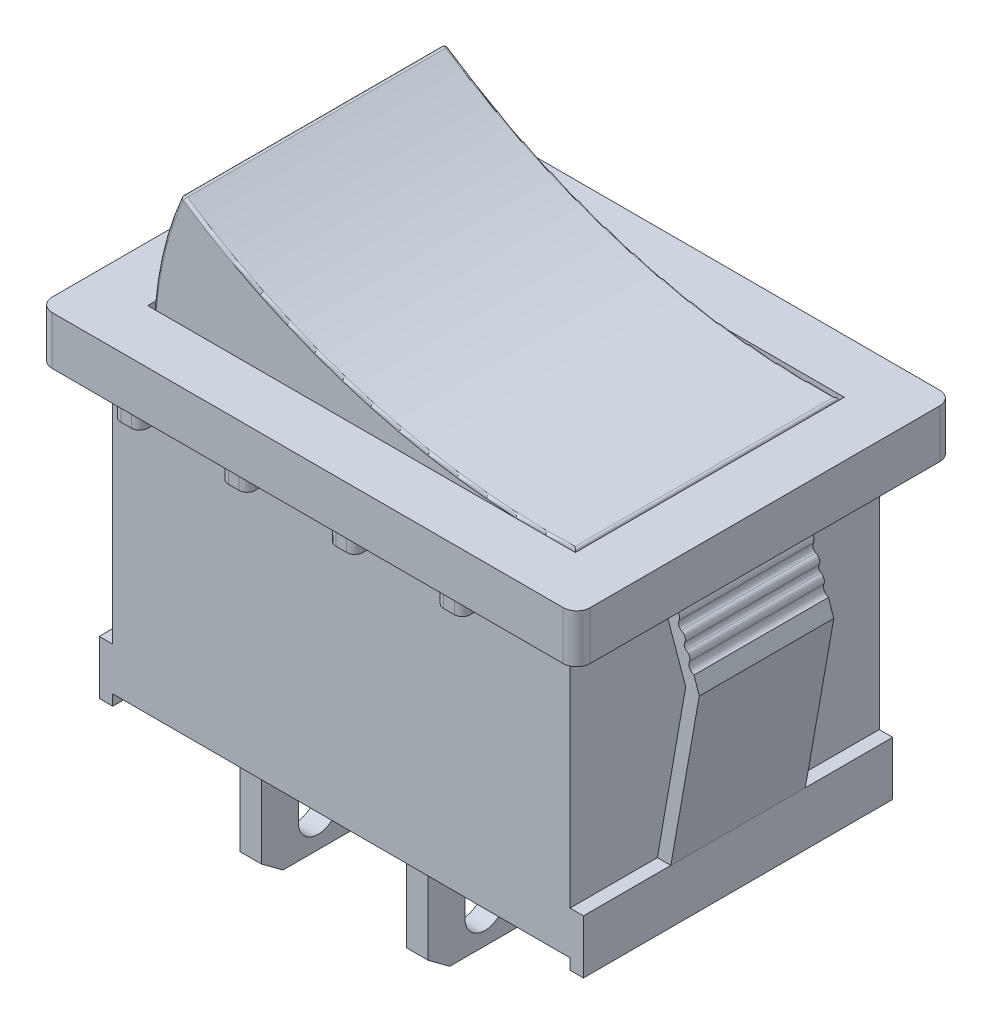
from build123d import *

# Parameters (mm, degrees)
BOSS_EXTRUDE1_DEPTH  = 11.5
SKETCH2_W            = 20
SKETCH2_H            = 14
BOSS_EXTRUDE2_DEPTH  = 1.8
BOSS_EXTRUDE3_DEPTH  = 5
SKETCH4_R            = 0.997087564
BOSS_EXTRUDE4_DEPTH  = 0.8
LPATTERN1_COUNT      = 2
LPATTERN1_PITCH      = 6.2
BOSS_EXTRUDE5_DEPTH  = 1.2
LPATTERN2_COUNT      = 4
LPATTERN2_PITCH      = 4
MIRROR1_COPY_1_DEPTH = 1.2
MIRROR1_COPY_2_DEPTH = 1.2
MIRROR1_COPY_3_DEPTH = 1.2
SKETCH7_W            = 17
SKETCH7_H            = 10
CUT_EXTRUDE1_DEPTH   = 1.5
BOSS_EXTRUDE7_DEPTH  = 9.8
SKETCH9_W            = 10.51284516
SKETCH9_H            = 1.648785174
BOSS_EXTRUDE8_DEPTH  = 0.55
SKETCH10_W           = 11.976389477
SKETCH10_H           = 1.66854767
BOSS_EXTRUDE9_DEPTH  = 0.55
FILLET1_R            = 0.5
FILLET2_R            = 0.1
BOSS_EXTRUDE10_REACH = 27.692
SKETCH11_W           = 3.457236269
SKETCH11_H           = 0.250916354


with BuildPart() as part:
    # Sketch1 → Boss-Extrude1 (new body)
    with BuildSketch(Plane.XY):
        Polygon((8.18934202, -3.835807166), (8.18934202, 5.164192834), (-8.81065798, 5.164192834), (-8.81065798, -3.835807166), (-9.31065798, -3.835807166), (-9.31065798, -5.835807166), (-8.81065798, -5.835807166), (-8.81065798, -5.435807166), (8.18934202, -5.435807166), (8.18934202, -5.835807166), (8.68934202, -5.835807166), (8.68934202, -3.835807166), align=None)
    extrude(amount=BOSS_EXTRUDE1_DEPTH)

    # Sketch2 → Boss-Extrude2 (add)
    with BuildSketch(Plane(origin=(0, 5.164192834, 0), x_dir=(1, 0, 0), z_dir=(0, 1, 0))):
        with Locations((-0.31065798, -5.75)):
            Rectangle(SKETCH2_W, SKETCH2_H)
    extrude(amount=BOSS_EXTRUDE2_DEPTH)

    # Sketch3 → Boss-Extrude3 (add)
    with BuildSketch(Plane.XY.offset(8.25)):
        with BuildLine():
            ThreePointArc((8.8583586, 4.521792747), (8.783242122, 4.675493292), (8.838809449, 4.83729136))
            ThreePointArc((8.838809449, 4.83729136), (8.833116674, 4.990542648), (8.729820429, 5.103892772))
            Line((8.729820429, 5.103892772), (8.729820429, 5.164192834))
            Line((8.729820429, 5.164192834), (8.18934202, 5.164192834))
            Line((8.18934202, 5.164192834), (9.241295814, 2.192836618))
            Line((9.241295814, 2.192836618), (8.18934202, -3.835807166))
            Line((8.18934202, -3.835807166), (8.68934202, -3.835807166))
            Line((8.68934202, -3.835807166), (9.74705296, 2.145085562))
            Line((9.74705296, 2.145085562), (9.54876746, 2.725463203))
            ThreePointArc((9.54876746, 2.725463203), (9.392073601, 2.857680829), (9.374766289, 3.061972099))
            ThreePointArc((9.374766289, 3.061972099), (9.386055579, 3.239564558), (9.26846148, 3.373124123))
            ThreePointArc((9.26846148, 3.373124123), (9.190190153, 3.486993506), (9.215361781, 3.622857506))
            ThreePointArc((9.215361781, 3.622857506), (9.209882663, 3.798156896), (9.082052954, 3.918237963))
            ThreePointArc((9.082052954, 3.918237963), (8.982000627, 4.045183698), (9.001017139, 4.205695566))
            ThreePointArc((9.001017139, 4.205695566), (8.995153739, 4.393289707), (8.8583586, 4.521792747))
        make_face()
        with BuildLine():
            Line((-9.768549251, 2.192836618), (-8.81065798, -3.835807166))
            Line((-8.81065798, -3.835807166), (-9.31065798, -3.835807166))
            Line((-9.31065798, -3.835807166), (-10.281052634, 2.145085562))
            Line((-10.281052634, 2.145085562), (-10.117876765, 2.665799097))
            ThreePointArc((-10.117876765, 2.665799097), (-9.936719279, 2.855408951), (-9.942696007, 3.117581051))
            ThreePointArc((-9.942696007, 3.117581051), (-9.904975068, 3.30471482), (-9.745978779, 3.410365644))
            ThreePointArc((-9.745978779, 3.410365644), (-9.685187207, 3.557129482), (-9.745978779, 3.703893321))
            ThreePointArc((-9.745978779, 3.703893321), (-9.70731856, 3.876152755), (-9.558175844, 3.970621666))
            ThreePointArc((-9.558175844, 3.970621666), (-9.525748947, 4.115107108), (-9.604986305, 4.240203023))
            ThreePointArc((-9.604986305, 4.240203023), (-9.516840398, 4.401701032), (-9.377451419, 4.521792747))
            ThreePointArc((-9.377451419, 4.521792747), (-9.313695789, 4.655646945), (-9.403030201, 4.773973145))
            Line((-9.403030201, 4.773973145), (-9.247843309, 5.164192834))
            Line((-9.247843309, 5.164192834), (-8.81065798, 5.164192834))
            Line((-8.81065798, 5.164192834), (-9.768549251, 2.192836618))
        make_face()
    extrude(amount=-BOSS_EXTRUDE3_DEPTH)

    # Sketch4 → Boss-Extrude4 (add)
    with BuildSketch(Plane(origin=(-7.71065798, 0, 0), x_dir=(0, 0, -1), z_dir=(1, 0, 0))):
        with BuildLine():
            Line((-4.469576646, -12.375307487), (-3.670369945, -11.774251208))
            Line((-3.670369945, -11.774251208), (-3.670369945, -6.737274439))
            ThreePointArc((-3.670369945, -6.737274439), (-3.640744564, -6.68616232), (-3.584133005, -6.66927317))
            Line((-3.584133005, -6.66927317), (-3.457236269, -6.66927317))
            Line((-3.457236269, -6.66927317), (-3.457236269, -5.36927317))
            Line((-3.457236269, -5.36927317), (-8.071520276, -5.36927317))
            Line((-8.071520276, -5.36927317), (-8.071520276, -6.66927317))
            Line((-8.071520276, -6.66927317), (-7.942223139, -6.66927317))
            ThreePointArc((-7.942223139, -6.66927317), (-7.892318864, -6.691603733), (-7.872821304, -6.742681477))
            Line((-7.872821304, -6.742681477), (-7.872821304, -11.779658246))
            Line((-7.872821304, -11.779658246), (-7.069576646, -12.375307487))
            Line((-7.069576646, -12.375307487), (-4.469576646, -12.375307487))
        make_face()
        with Locations((-5.759828942, -7.049379416)):
            Circle(SKETCH4_R, mode=Mode.SUBTRACT)
        with BuildLine():
            Line((-5.018096399, -9.591172621), (-5.018096399, -11.135690223))
            ThreePointArc((-5.018096399, -11.135690223), (-5.759828942, -11.877422766), (-6.501561485, -11.135690223))
            Line((-6.501561485, -11.135690223), (-6.501561485, -9.591172621))
            ThreePointArc((-6.501561485, -9.591172621), (-5.759828942, -8.849440078), (-5.018096399, -9.591172621))
        make_face(mode=Mode.SUBTRACT)
    boss_extrude4 = extrude(amount=BOSS_EXTRUDE4_DEPTH)

    # LPattern1: Boss-Extrude4 ×2
    with Locations(*[(i * LPATTERN1_PITCH, 0, 0) for i in range(1, LPATTERN1_COUNT)]):
        add(boss_extrude4)

    # Sketch5 → Boss-Extrude5 (add)
    with BuildSketch(Plane.XZ.offset(-5.164192834)):
        with BuildLine():
            Line((-8.31065798, 11.5), (-8.31065798, 11.7))
            ThreePointArc((-8.31065798, 11.7), (-8.222790015, 11.912132034), (-8.01065798, 12))
            Line((-8.01065798, 12), (-7.61065798, 12))
            ThreePointArc((-7.61065798, 12), (-7.398525946, 11.912132034), (-7.31065798, 11.7))
            Line((-7.31065798, 11.7), (-7.31065798, 11.5))
            Line((-7.31065798, 11.5), (-8.31065798, 11.5))
        make_face()
    boss_extrude5 = extrude(amount=BOSS_EXTRUDE5_DEPTH)

    # LPattern2: Boss-Extrude5 ×4
    with Locations(*[(i * LPATTERN2_PITCH, 0, 0) for i in range(1, LPATTERN2_COUNT)]):
        add(boss_extrude5)

    # Mirror1: Boss-Extrude5 across plane
    add(boss_extrude5.mirror(Plane.XY.offset(5.75)))

    # Mirror1 copy 1 sketch → Mirror1 copy 1 (add)
    with BuildSketch(Plane(origin=(4, 5.164192834, 11.5), x_dir=(1, 0, 0), z_dir=(0, -1, 0))):
        with BuildLine():
            Line((-8.31065798, -11.5), (-8.31065798, -11.7))
            ThreePointArc((-8.31065798, -11.7), (-8.222790015, -11.912132034), (-8.01065798, -12))
            Line((-8.01065798, -12), (-7.61065798, -12))
            ThreePointArc((-7.61065798, -12), (-7.398525946, -11.912132034), (-7.31065798, -11.7))
            Line((-7.31065798, -11.7), (-7.31065798, -11.5))
            Line((-7.31065798, -11.5), (-8.31065798, -11.5))
        make_face()
    extrude(amount=MIRROR1_COPY_1_DEPTH)

    # Mirror1 copy 2 sketch → Mirror1 copy 2 (add)
    with BuildSketch(Plane(origin=(8, 5.164192834, 11.5), x_dir=(1, 0, 0), z_dir=(0, -1, 0))):
        with BuildLine():
            Line((-8.31065798, -11.5), (-8.31065798, -11.7))
            ThreePointArc((-8.31065798, -11.7), (-8.222790015, -11.912132034), (-8.01065798, -12))
            Line((-8.01065798, -12), (-7.61065798, -12))
            ThreePointArc((-7.61065798, -12), (-7.398525946, -11.912132034), (-7.31065798, -11.7))
            Line((-7.31065798, -11.7), (-7.31065798, -11.5))
            Line((-7.31065798, -11.5), (-8.31065798, -11.5))
        make_face()
    extrude(amount=MIRROR1_COPY_2_DEPTH)

    # Mirror1 copy 3 sketch → Mirror1 copy 3 (add)
    with BuildSketch(Plane(origin=(12, 5.164192834, 11.5), x_dir=(1, 0, 0), z_dir=(0, -1, 0))):
        with BuildLine():
            Line((-8.31065798, -11.5), (-8.31065798, -11.7))
            ThreePointArc((-8.31065798, -11.7), (-8.222790015, -11.912132034), (-8.01065798, -12))
            Line((-8.01065798, -12), (-7.61065798, -12))
            ThreePointArc((-7.61065798, -12), (-7.398525946, -11.912132034), (-7.31065798, -11.7))
            Line((-7.31065798, -11.7), (-7.31065798, -11.5))
            Line((-7.31065798, -11.5), (-8.31065798, -11.5))
        make_face()
    extrude(amount=MIRROR1_COPY_3_DEPTH)

    # Sketch7 → Cut-Extrude1 (cut)
    with BuildSketch(Plane(origin=(0, 6.964192834, 0), x_dir=(1, 0, 0), z_dir=(0, 1, 0))):
        with Locations((-0.31065798, -5.75)):
            Rectangle(SKETCH7_W, SKETCH7_H)
    extrude(amount=-CUT_EXTRUDE1_DEPTH, mode=Mode.SUBTRACT)

    # Sketch8 → Boss-Extrude7 (add)
    with BuildSketch(Plane.XY.offset(0.85)):
        with BuildLine():
            Line((7.53934202, 5.445280313), (7.53934202, 6.964192834))
            ThreePointArc((7.53934202, 6.964192834), (-0.098559128, 7.844883043), (-7.08211842, 11.060944111))
            ThreePointArc((-7.08211842, 11.060944111), (-7.943068249, 8.314893806), (-8.16065798, 5.445280313))
            Line((-8.16065798, 5.445280313), (7.53934202, 5.445280313))
        make_face()
    extrude(amount=BOSS_EXTRUDE7_DEPTH)

    # Sketch9 → Boss-Extrude8 (add)
    with BuildSketch(Plane(origin=(-8.81065798, 0, 0), x_dir=(0, 0, -1), z_dir=(1, 0, 0))):
        with Locations((-5.794182097, 6.139800247)):
            Rectangle(SKETCH9_W, SKETCH9_H)
    extrude(amount=BOSS_EXTRUDE8_DEPTH)

    # Sketch10 → Boss-Extrude9 (add)
    with BuildSketch(Plane.ZY.offset(-8.18934202)):
        with Locations((5.751974848, 6.129918999)):
            Rectangle(SKETCH10_W, SKETCH10_H)
    extrude(amount=BOSS_EXTRUDE9_DEPTH)

    # Fillet1
    fillet1_edges = [part.edges().sort_by_distance(p)[0] for p in [
        (-10.31065798, 6.064192834, -1.25),
        (-10.31065798, 6.064192834, 12.75),
        (9.68934202, 6.064192834, 12.75),
        (9.68934202, 6.064192834, -1.25),
    ]]
    fillet(fillet1_edges, radius=FILLET1_R)

    # Fillet2
    fillet2_edges = [part.edges().sort_by_distance(p)[0] for p in [
        (-0.098559128, 7.844883043, 0.85),
        (7.53934202, 6.964192834, 5.75),
        (-7.08211842, 11.060944111, 5.75),
        (-7.941279942, 8.324186256, 0.85),
        (-0.098559128, 7.844883043, 10.65),
        (-7.941279942, 8.324186256, 10.65),
    ]]
    fillet(fillet2_edges, radius=FILLET2_R)

    # Sketch11 → Boss-Extrude10 (add, up to next)
    with BuildSketch(Plane(origin=(-8.81065798, 0, 0), x_dir=(0, 0, -1), z_dir=(1, 0, 0)), mode=Mode.PRIVATE) as boss_extrude10_sk1:
        with Locations((-1.728618135, -5.380348989)):
            Rectangle(SKETCH11_W, SKETCH11_H)
    boss_extrude10_tool1 = extrude(boss_extrude10_sk1.sketch, amount=BOSS_EXTRUDE10_REACH, mode=Mode.PRIVATE) - part.part
    add(boss_extrude10_tool1.solids().sort_by_distance((-8.810658, -5.380349, 1.728618))[0])


solid = part.part
